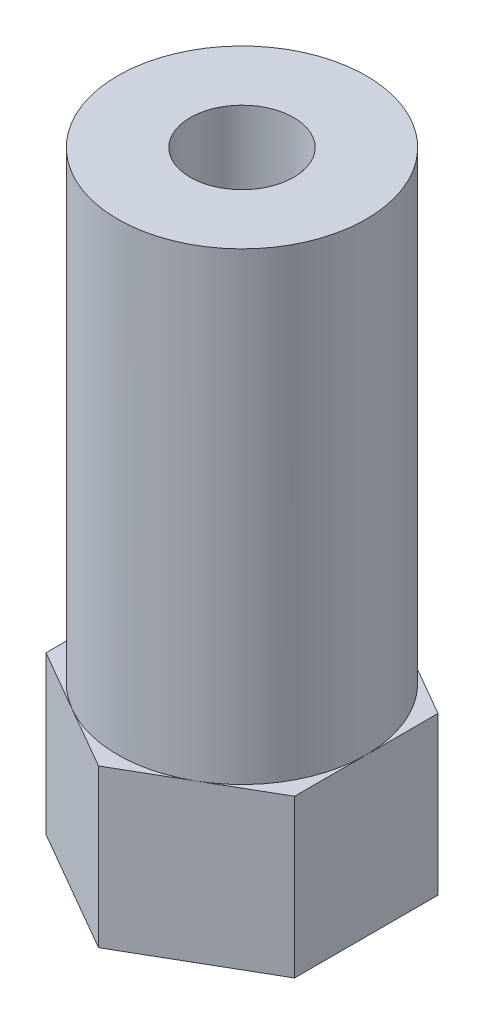
from build123d import *

# Parameters (mm, degrees)
BOSS_EXTRUDE1_DEPTH = 7.6
SKETCH2_R           = 6
BOSS_EXTRUDE2_DEPTH = 22.4
SKETCH3_R           = 2.5
CUT_EXTRUDE1_DEPTH  = 32.368774283
SKETCH4_R           = 1
CUT_EXTRUDE2_DEPTH  = 15.4


with BuildPart() as part:
    # Sketch1 → Boss-Extrude1 (new body)
    with BuildSketch(Plane(origin=(0, 0, 0), x_dir=(1, 0, 0), z_dir=(0, 1, 0))):
        Polygon((0, -6.92820323), (6, -3.464101615), (6, 3.464101615), (0, 6.92820323), (-6, 3.464101615), (-6, -3.464101615), align=None)
    extrude(amount=BOSS_EXTRUDE1_DEPTH)

    # Sketch2 → Boss-Extrude2 (add)
    with BuildSketch(Plane(origin=(0, 7.6, 0), x_dir=(1, 0, 0), z_dir=(0, 1, 0))):
        with Locations(Location((0, 0, 0), (0, 0, 120))):
            Circle(SKETCH2_R)
    extrude(amount=BOSS_EXTRUDE2_DEPTH)

    # Sketch3 → Cut-Extrude1 (cut, through all)
    with BuildSketch(Plane(origin=(0, 30, 0), x_dir=(1, 0, 0), z_dir=(0, 1, 0))):
        with Locations(Location((0, 0, 0), (0, 0, 270))):
            Circle(SKETCH3_R)
    extrude(amount=-CUT_EXTRUDE1_DEPTH, mode=Mode.SUBTRACT)

    # Sketch4 → Cut-Extrude2 (cut)
    with BuildSketch(Plane(origin=(8, 0, -13.856406461), x_dir=(-0.8660254037844316, 0, -0.5000000000000123), z_dir=(0.5000000000000123, 0, -0.8660254037844316))):
        with Locations((0, 27.46)):
            Circle(SKETCH4_R)
    extrude(amount=-CUT_EXTRUDE2_DEPTH, mode=Mode.SUBTRACT)


solid = part.part
